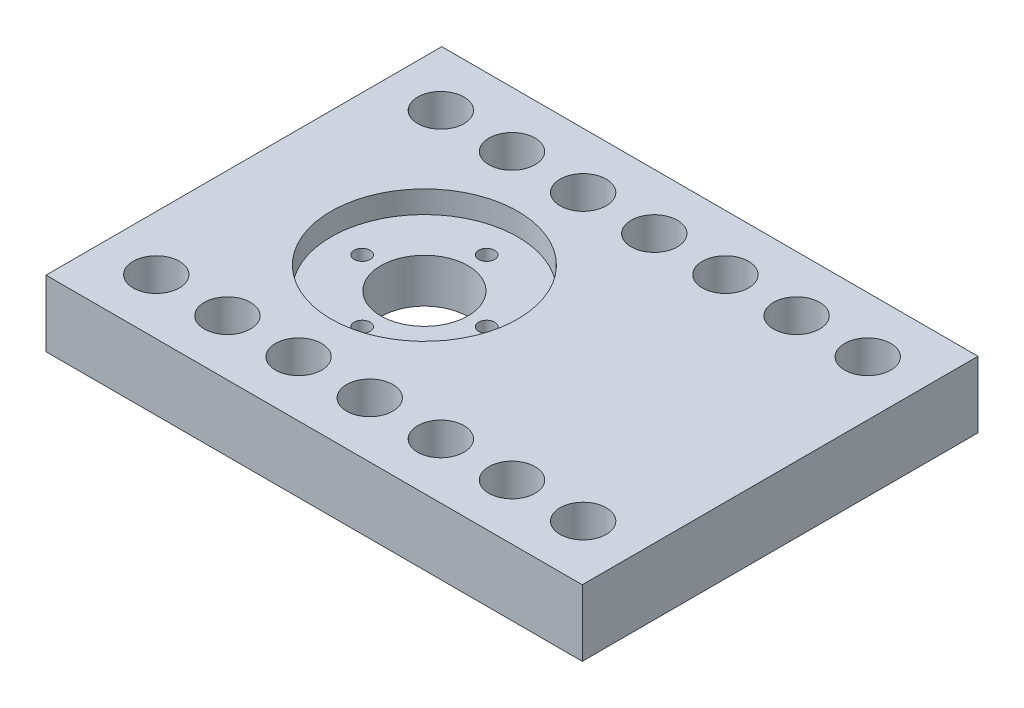
from build123d import *

# Parameters (mm, degrees)
SKETCH3_W           = 60.3
SKETCH3_H           = 44.5
SKETCH3_R           = 0.9
SKETCH3_R_2         = 4.9
BOSS_EXTRUDE1_DEPTH = 7.46
SKETCH4_R           = 10.5
CUT_EXTRUDE1_DEPTH  = 2.5
SKETCH5_R           = 2.6
CUT_EXTRUDE2_DEPTH  = 39.206499447


with BuildPart() as part:
    # Sketch3 → Boss-Extrude1 (new body)
    with BuildSketch(Plane(origin=(0, 0, 0), x_dir=(1, 0, 0), z_dir=(0, 1, 0))):
        Rectangle(SKETCH3_W, SKETCH3_H)
        with Locations(Location((-9.85, 7, 0), (0, 0, 90))):
            Circle(SKETCH3_R, mode=Mode.SUBTRACT)
        with Locations(Location((-16.85, 0, 0), (0, 0, 90))):
            Circle(SKETCH3_R, mode=Mode.SUBTRACT)
        with Locations(Location((-9.85, -7, 0), (0, 0, 90))):
            Circle(SKETCH3_R, mode=Mode.SUBTRACT)
        with Locations(Location((-2.85, 0, 0), (0, 0, 90))):
            Circle(SKETCH3_R, mode=Mode.SUBTRACT)
        with Locations(Location((-9.85, 0, 0), (0, 0, 90))):
            Circle(SKETCH3_R_2, mode=Mode.SUBTRACT)
    extrude(amount=BOSS_EXTRUDE1_DEPTH)

    # Sketch4 → Cut-Extrude1 (cut)
    with BuildSketch(Plane(origin=(0, 7.46, 0), x_dir=(1, 0, 0), z_dir=(0, 1, 0))):
        with Locations(Location((-9.85, 0, 0), (0, 0, 270))):
            Circle(SKETCH4_R)
    extrude(amount=-CUT_EXTRUDE1_DEPTH, mode=Mode.SUBTRACT)

    # Sketch5 → Cut-Extrude2 (cut, through all)
    with BuildSketch(Plane(origin=(0, 7.46, 0), x_dir=(1, 0, 0), z_dir=(0, 1, 0))):
        with Locations(Location((0, 16, 0), (0, 0, 270))):
            Circle(SKETCH5_R)
        with Locations(Location((8, 16, 0), (0, 0, 270))):
            Circle(SKETCH5_R)
        with Locations(Location((16, 16, 0), (0, 0, 270))):
            Circle(SKETCH5_R)
        with Locations(Location((24, 16, 0), (0, 0, 270))):
            Circle(SKETCH5_R)
        with Locations(Location((-24, 16, 0), (0, 0, 270))):
            Circle(SKETCH5_R)
        with Locations(Location((-16, 16, 0), (0, 0, 270))):
            Circle(SKETCH5_R)
        with Locations(Location((-8, 16, 0), (0, 0, 270))):
            Circle(SKETCH5_R)
        with Locations(Location((-8, -16, 0), (0, 0, 270))):
            Circle(SKETCH5_R)
        with Locations(Location((-16, -16, 0), (0, 0, 270))):
            Circle(SKETCH5_R)
        with Locations(Location((-24, -16, 0), (0, 0, 270))):
            Circle(SKETCH5_R)
        with Locations(Location((24, -16, 0), (0, 0, 270))):
            Circle(SKETCH5_R)
        with Locations(Location((16, -16, 0), (0, 0, 270))):
            Circle(SKETCH5_R)
        with Locations(Location((8, -16, 0), (0, 0, 270))):
            Circle(SKETCH5_R)
        with Locations(Location((0, -16, 0), (0, 0, 270))):
            Circle(SKETCH5_R)
    extrude(amount=-CUT_EXTRUDE2_DEPTH, mode=Mode.SUBTRACT)


solid = part.part
